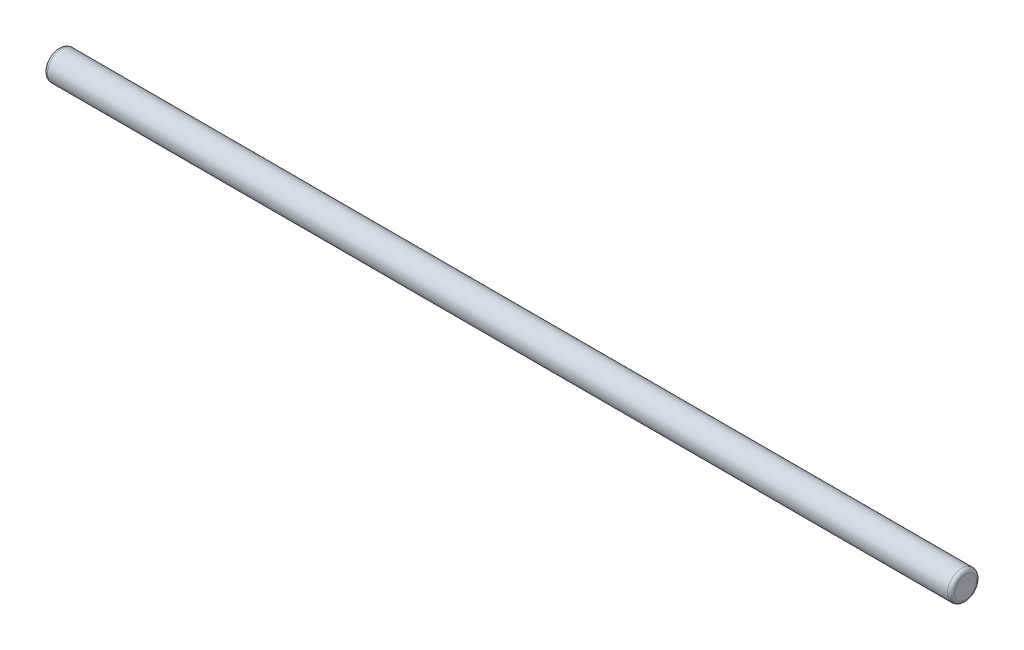
from build123d import *

# Parameters (mm, degrees)
PROFILESKETCH1_R           = 4
PROFILEBOSS_EXTRUDE1_DEPTH = 250
FILLET1_R                  = 1


with BuildPart() as part:
    # ProfileSketch1 → ProfileBoss-Extrude1 (new body)
    with BuildSketch(Plane(origin=(0, 0, 0), x_dir=(0, 0, -1), z_dir=(1, 0, 0))):
        Circle(PROFILESKETCH1_R)
    extrude(amount=PROFILEBOSS_EXTRUDE1_DEPTH)

    # Fillet1
    fillet1_edges = [part.edges().sort_by_distance(p)[0] for p in [
        (0, 0, 4),
        (250, 0, 4),
    ]]
    fillet(fillet1_edges, radius=FILLET1_R)


solid = part.part
